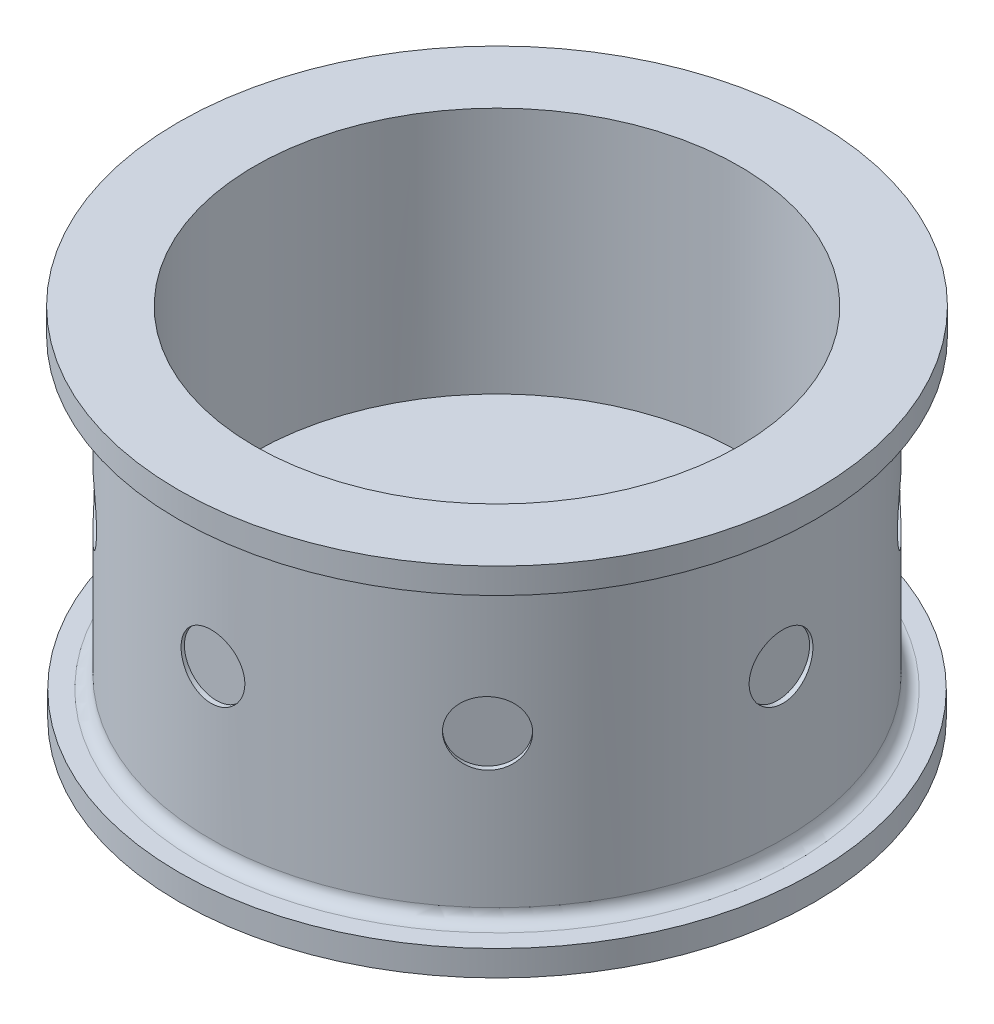
from build123d import *

# Parameters (mm, degrees)
SKETCH1_R               = 22.4
SKETCH1_R_2             = 19
BOSS_EXTRUDE1_DEPTH     = 28
BOSS_EXTRUDE2_DEPTH     = 8.6
SKETCH3_R               = 4
CUT_EXTRUDE1_DEPTH      = 9
SKETCH4_R               = 24.9
SKETCH4_R_2             = 22.3905802
BOSS_EXTRUDE3_DEPTH     = 2
BOSS_EXTRUDE4_START     = -2
SKETCH5_R               = 24.964272213
SKETCH5_R_2             = 22.4
BOSS_EXTRUDE4_DEPTH     = 2
FILLET1_R               = 1
SKETCH7_R               = 1.585
CUT_EXTRUDE2_DEPTH      = 32
SKETCH8_R               = 2.5
CUT_EXTRUDE3_DEPTH      = 3
SKETCH9_R               = 2.5
CUT_EXTRUDE4_DEPTH      = 3
SKETCH10_R              = 2.5
CUT_EXTRUDE5_DEPTH      = 3
MIRROR6_COPY_1_SKETCH_R = 2.5
MIRROR6_COPY_1_DEPTH    = 3
MIRROR6_COPY_2_SKETCH_R = 2.5
MIRROR6_COPY_2_DEPTH    = 3


with BuildPart() as part:
    # Sketch1 → Boss-Extrude1 (new body)
    with BuildSketch(Plane(origin=(0, 0, 0), x_dir=(1, 0, 0), z_dir=(0, 1, 0))):
        with Locations(Location((0, 0, 0), (0, 0, 270))):
            Circle(SKETCH1_R)
        with Locations(Location((0, 0, 0), (0, 0, 270))):
            Circle(SKETCH1_R_2, mode=Mode.SUBTRACT)
    extrude(amount=BOSS_EXTRUDE1_DEPTH)

    # Sketch2 → Boss-Extrude2 (add)
    with BuildSketch(Plane.XZ):
        with BuildLine():
            Line((-22.4, 0), (0, 0))
            Line((0, 0), (22.4, 0))
            ThreePointArc((22.4, 0), (0, -22.4), (-22.4, 0))
        make_face()
    extrude(amount=-BOSS_EXTRUDE2_DEPTH)

    # Sketch3 → Cut-Extrude1 (cut)
    with BuildSketch(Plane(origin=(0, 0, 0), x_dir=(-1, 0, 0), z_dir=(0, -1, 0))):
        Circle(SKETCH3_R)
    extrude(amount=-CUT_EXTRUDE1_DEPTH, mode=Mode.SUBTRACT)

    # Sketch4 → Boss-Extrude3 (add)
    with BuildSketch(Plane(origin=(0, 0, 0), x_dir=(-1, 0, 0), z_dir=(0, -1, 0))):
        with Locations(Location((0, 0, 0), (0, 0, 90))):
            Circle(SKETCH4_R)
        Circle(SKETCH4_R_2, mode=Mode.SUBTRACT)
    extrude(amount=-BOSS_EXTRUDE3_DEPTH)

    # Sketch5 → Boss-Extrude4 (add)
    with BuildSketch(Plane(origin=(0, 28, 0), x_dir=(1, 0, 0), z_dir=(0, 1, 0)).offset(BOSS_EXTRUDE4_START)):
        with Locations(Location((0, 0, 0), (0, 0, 270))):
            Circle(SKETCH5_R)
        with Locations(Location((0, 0, 0), (0, 0, 90))):
            Circle(SKETCH5_R_2, mode=Mode.SUBTRACT)
    extrude(amount=BOSS_EXTRUDE4_DEPTH)

    # Fillet1
    fillet1_edges = [part.edges().sort_by_distance(p)[0] for p in [
        (0, 2, -22.4),
        (0, 26, -22.4),
    ]]
    fillet(fillet1_edges, radius=FILLET1_R)

    # Sketch7 → Cut-Extrude2 (cut)
    with BuildSketch(Plane.XY.offset(-25)):
        with Locations(Location((-9.5, 4.5, 0), (0, 0, 251.150810429))):
            Circle(SKETCH7_R)
    cut_extrude2 = extrude(amount=CUT_EXTRUDE2_DEPTH, mode=Mode.SUBTRACT)

    # Mirror1: Cut-Extrude2 across plane
    add(cut_extrude2.mirror(Plane(origin=(0, 0, 0), x_dir=(0, 0, 1), z_dir=(1, 0, 0))), mode=Mode.SUBTRACT)

    # Sketch8 → Cut-Extrude3 (cut)
    with BuildSketch(Plane.XY.offset(-25)):
        with Locations(Location((0, 14.732501926, 0), (0, 0, 90))):
            Circle(SKETCH8_R)
    cut_extrude3 = extrude(amount=CUT_EXTRUDE3_DEPTH, mode=Mode.SUBTRACT)

    # Mirror2: Cut-Extrude3 across plane
    add(cut_extrude3.mirror(Plane.XY), mode=Mode.SUBTRACT)

    # Sketch9 → Cut-Extrude4 (cut)
    with BuildSketch(Plane(origin=(25, 0, 0), x_dir=(0, 0, -1), z_dir=(1, 0, 0))):
        with Locations((0, 14.732501926)):
            Circle(SKETCH9_R)
    cut_extrude4 = extrude(amount=-CUT_EXTRUDE4_DEPTH, mode=Mode.SUBTRACT)

    # Mirror3: Cut-Extrude4 across plane
    add(cut_extrude4.mirror(Plane(origin=(0, 0, 0), x_dir=(0, 0, 1), z_dir=(1, 0, 0))), mode=Mode.SUBTRACT)

    # Sketch10 → Cut-Extrude5 (cut)
    with BuildSketch(Plane(origin=(17.67766953, 0, -17.67766953), x_dir=(-0.7071067811865477, 0, -0.7071067811865475), z_dir=(0.7071067811865475, 0, -0.7071067811865477))):
        with Locations((-0.521742336, 14.830490085)):
            Circle(SKETCH10_R)
    cut_extrude5 = extrude(amount=-CUT_EXTRUDE5_DEPTH, mode=Mode.SUBTRACT)

    # Mirror4: Cut-Extrude5 across plane
    add(cut_extrude5.mirror(Plane(origin=(0, 0, 0), x_dir=(0.7071067811865478, 0, 0.7071067811865472), z_dir=(0.7071067811865475, 0, -0.7071067811865477))), mode=Mode.SUBTRACT)

    # Mirror5: Cut-Extrude5 across plane
    add(cut_extrude5.mirror(Plane(origin=(0, 0, 0), x_dir=(0, 0, 1), z_dir=(1, 0, 0))), mode=Mode.SUBTRACT)

    # Mirror6 copy 1 sketch → Mirror6 copy 1 (cut)
    with BuildSketch(Plane(origin=(17.67766953, 0, 17.67766953), x_dir=(0.7071067811865477, 0, -0.7071067811865475), z_dir=(0.7071067811865477, 0, 0.7071067811865479))):
        with Locations((-0.521742336, 14.830490085)):
            Circle(MIRROR6_COPY_1_SKETCH_R)
    extrude(amount=-MIRROR6_COPY_1_DEPTH, mode=Mode.SUBTRACT)

    # Mirror6 copy 2 sketch → Mirror6 copy 2 (cut)
    with BuildSketch(Plane(origin=(-17.67766953, 0, -17.67766953), x_dir=(0.7071067811865477, 0, -0.7071067811865475), z_dir=(-0.7071067811865475, 0, -0.7071067811865477))):
        with Locations((-0.521742336, -14.830490085)):
            Circle(MIRROR6_COPY_2_SKETCH_R)
    extrude(amount=-MIRROR6_COPY_2_DEPTH, mode=Mode.SUBTRACT)


solid = part.part
